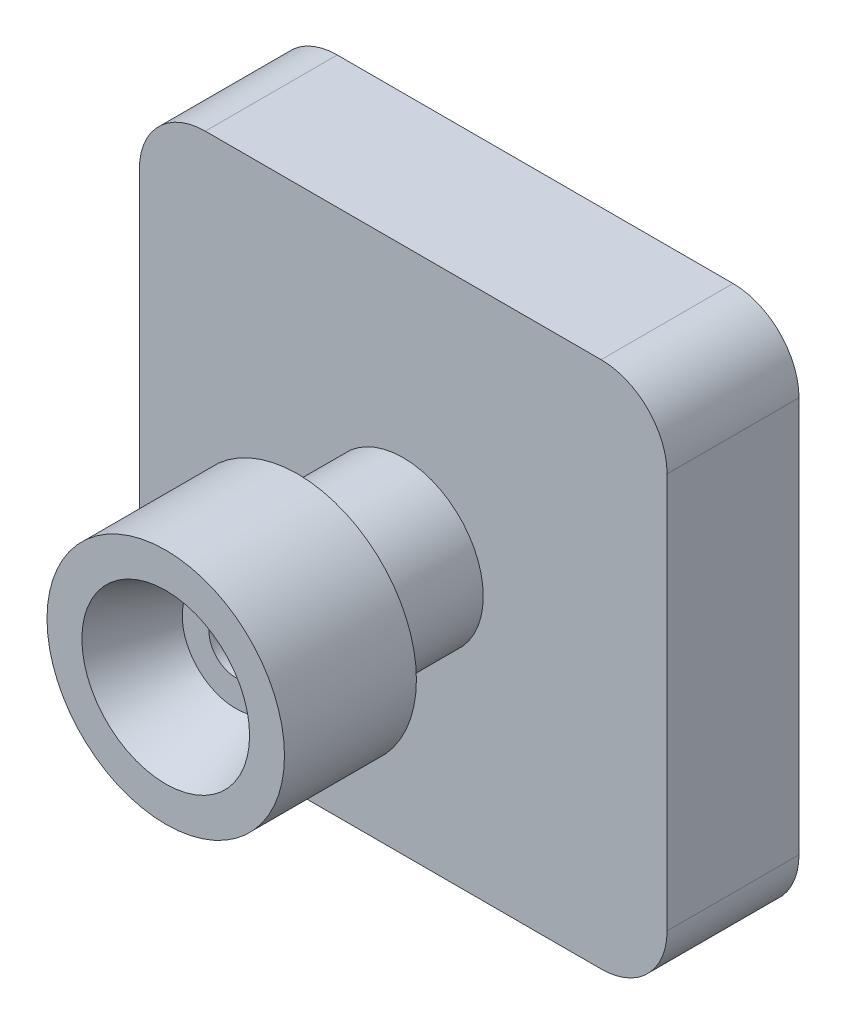
from build123d import *

# Parameters (mm, degrees)
SKETCH_1_R      = 9
EXTRUDE_1_DEPTH = 10
SKETCH_3_R      = 4.061339688
SKETCH_3_R_2    = 2.034438867
EXTRUDE_2_DEPTH = 2
SKETCH_4_R      = 6.066882161
EXTRUDE_3_DEPTH = 8
EXTRUDE_4_DEPTH = 10


with BuildPart() as part:
    # Эскиз1 → Бобышка-Вытянуть1 (new body)
    with BuildSketch(Plane.XY):
        Circle(SKETCH_1_R)
    extrude(amount=EXTRUDE_1_DEPTH)

    # Эскиз2 → Вырез-Повернуть1 (revolve, cut)
    with BuildSketch(Plane(origin=(0, 0, 0), x_dir=(1, 0, 0), z_dir=(0, 1, 0)), mode=Mode.PRIVATE) as cut_revolve_1_sk:
        Polygon((0, -10), (6.354968878, -10), (3.421999094, -2.687643664), (0, -2.687643664), align=None)
    revolve(cut_revolve_1_sk.sketch.rotate(Axis((0, 0, 2.687643664), (0, 0, 1)), 180), axis=Axis((0, 0, 2.687643664), (0, 0, 1)), mode=Mode.SUBTRACT)

    # Эскиз3 → Бобышка-Вытянуть2 (add)
    with BuildSketch(Plane.XY.offset(2.687643664)):
        Circle(SKETCH_3_R)
        Circle(SKETCH_3_R_2, mode=Mode.SUBTRACT)
    extrude(amount=EXTRUDE_2_DEPTH)

    # Эскиз4 → Бобышка-Вытянуть3 (add)
    with BuildSketch(Plane(origin=(0, 0, 0), x_dir=(-1, 0, 0), z_dir=(0, 0, -1))):
        with Locations(Location((0, 0, 0), (0, 0, 180))):
            Circle(SKETCH_4_R)
    extrude(amount=EXTRUDE_3_DEPTH)


with BuildPart() as body_2:
    # Эскиз5 → Бобышка-Вытянуть4 (new body)
    with BuildSketch(Plane(origin=(0, 0, -8), x_dir=(-1, 0, 0), z_dir=(0, 0, -1))):
        with BuildLine():
            Line((-15, -20), (15, -20))
            ThreePointArc((15, -20), (18.535533906, -18.535533906), (20, -15))
            Line((20, -15), (20, 15))
            ThreePointArc((20, 15), (18.535533906, 18.535533906), (15, 20))
            Line((15, 20), (-15, 20))
            ThreePointArc((-15, 20), (-18.535533906, 18.535533906), (-20, 15))
            Line((-20, 15), (-20, -15))
            ThreePointArc((-20, -15), (-18.535533906, -18.535533906), (-15, -20))
        make_face()
    extrude(amount=EXTRUDE_4_DEPTH)


solid = Compound([part.part, body_2.part])
